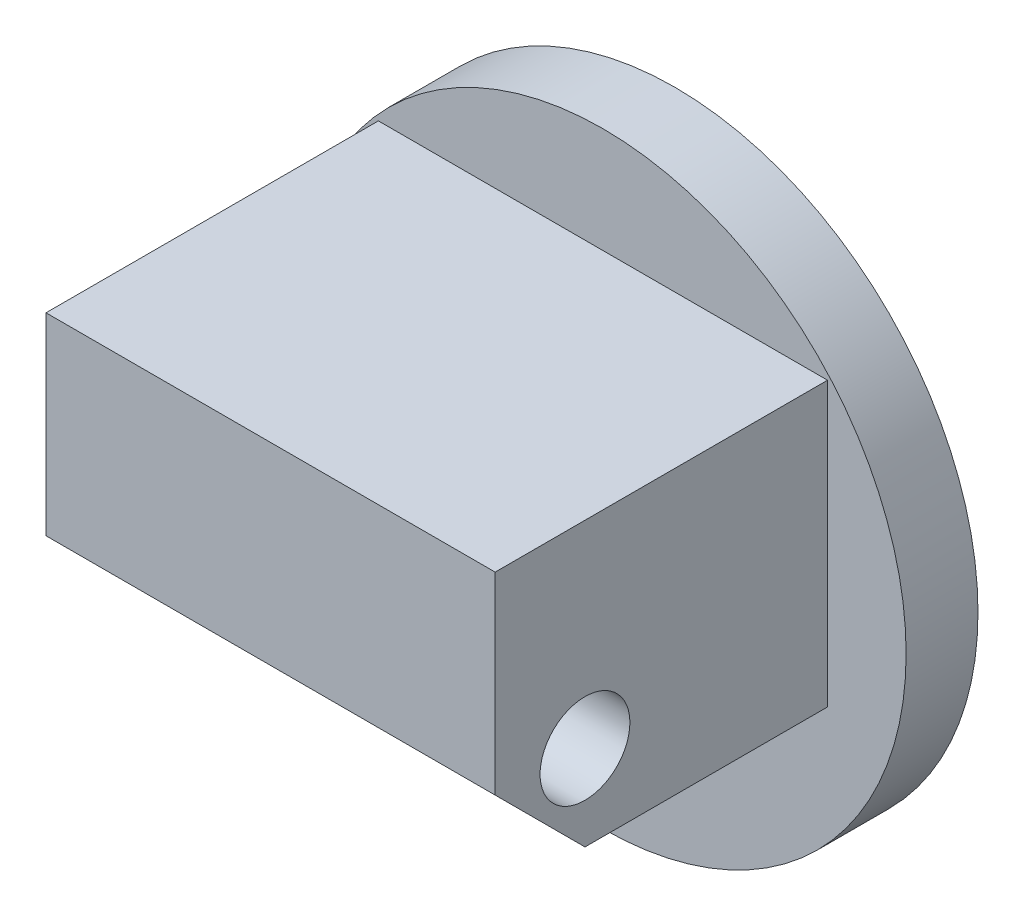
from build123d import *

# Parameters (mm, degrees)
SKETCH1_R               = 6.75
BOSS_EXTRUDE1_DEPTH     = 9
SKETCH2_R               = 5
BOSS_EXTRUDE2_DEPTH     = 1
CUT_EXTRUDE1_DEPTH      = 14.119641763
CUT_EXTRUDE1_DEPTH_BACK = 14.119641763
SKETCH3_W               = 1.75
SKETCH3_H               = 7.4
CUT_EXTRUDE2_DEPTH      = 14.119641763
CUT_EXTRUDE2_DEPTH_BACK = 14.119641763
SKETCH4_W               = 7.4
SKETCH4_H               = 4.85
SKETCH4_H_2             = 2.35
CUT_EXTRUDE3_DEPTH      = 17.267298485
CUT_EXTRUDE3_DEPTH_BACK = 17.267298485
SKETCH5_R               = 1
CHAMFER1_SIZE           = 2


with BuildPart() as part:
    # Sketch1 → Boss-Extrude1 (new body)
    with BuildSketch(Plane.XY):
        Circle(SKETCH1_R)
    extrude(amount=BOSS_EXTRUDE1_DEPTH)

    # Sketch2 → Boss-Extrude2 (add)
    with BuildSketch(Plane(origin=(0, 0, 0), x_dir=(-1, 0, 0), z_dir=(0, 0, -1))):
        Circle(SKETCH2_R)
    extrude(amount=BOSS_EXTRUDE2_DEPTH)

    # Sketch3 → Cut-Extrude1 (cut, two sides: drawn at the far end of the back side and taken through both)
    with BuildSketch(Plane(origin=(0, 0, 0), x_dir=(1, 0, 0), z_dir=(0, 1, 0)).offset(-CUT_EXTRUDE1_DEPTH_BACK)):
        with Locations((-5.875, -5.3)):
            Rectangle(SKETCH3_W, SKETCH3_H)
        with Locations((5.875, -5.3)):
            Rectangle(SKETCH3_W, SKETCH3_H)
    extrude(amount=CUT_EXTRUDE1_DEPTH + CUT_EXTRUDE1_DEPTH_BACK, mode=Mode.SUBTRACT)

    # Sketch4 → Cut-Extrude2 (cut, two sides: drawn at the far end of the back side and taken through both)
    with BuildSketch(Plane(origin=(0, 0, 0), x_dir=(0, 0, -1), z_dir=(1, 0, 0)).offset(-CUT_EXTRUDE2_DEPTH_BACK)):
        with Locations((-5.3, -4.325)):
            Rectangle(SKETCH4_W, SKETCH4_H)
        with Locations((-5.3, 5.575)):
            Rectangle(SKETCH4_W, SKETCH4_H_2)
    extrude(amount=CUT_EXTRUDE2_DEPTH + CUT_EXTRUDE2_DEPTH_BACK, mode=Mode.SUBTRACT)

    # Sketch5 → Cut-Extrude3 (cut, two sides: drawn at the far end of the back side and taken through both)
    with BuildSketch(Plane(origin=(5, 0, 0), x_dir=(0, 0, -1), z_dir=(1, 0, 0)).offset(-CUT_EXTRUDE3_DEPTH_BACK)):
        with Locations((-7, 0)):
            Circle(SKETCH5_R)
    extrude(amount=CUT_EXTRUDE3_DEPTH + CUT_EXTRUDE3_DEPTH_BACK, mode=Mode.SUBTRACT)

    # Chamfer1
    chamfer1_edges = [part.edges().sort_by_distance(p)[0] for p in [
        (0, -1.9, 9),
    ]]
    chamfer(chamfer1_edges, length=CHAMFER1_SIZE)


solid = part.part
